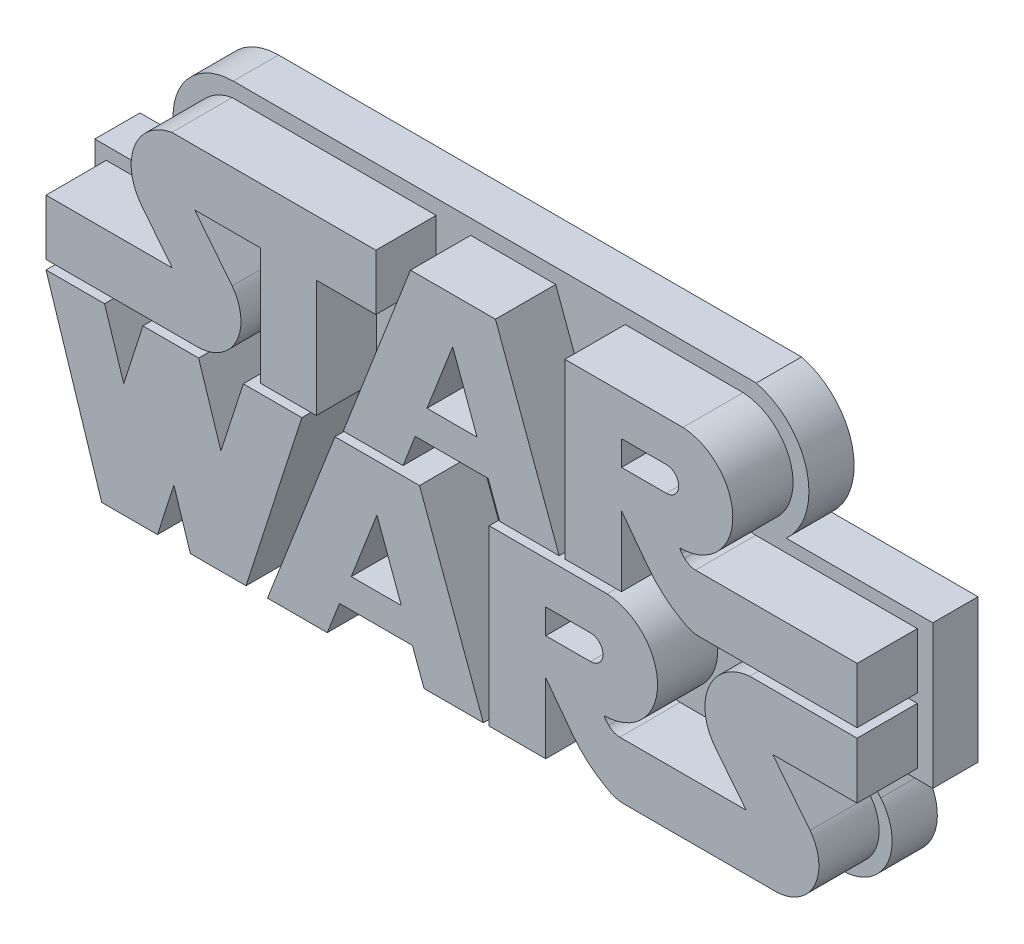
from build123d import *

# Parameters (mm, degrees)
BOSS_EXTRUDE1_DEPTH   = 17.78
BOSS_EXTRUDE1_2_DEPTH = 17.78
BOSS_EXTRUDE1_3_DEPTH = 17.78
BOSS_EXTRUDE1_4_DEPTH = 17.78
BOSS_EXTRUDE1_5_DEPTH = 17.78
BOSS_EXTRUDE1_6_DEPTH = 17.78
BOSS_EXTRUDE2_DEPTH   = 7.62


with BuildPart() as part:
    # Sketch1 → Boss-Extrude1 (new body)
    with BuildSketch(Plane.XY):
        with BuildLine():
            Line((-63.5, 10.16), (-63.5, 0.762))
            Line((-63.5, 0.762), (-38.022245391, 0.762))
            ThreePointArc((-38.022245391, 0.762), (-31.409051973, 4.854056156), (-32.119852619, 12.598345226))
            Line((-32.119852619, 12.598345226), (-38.427776706, 20.532214336))
            Line((-38.427776706, 20.532214336), (-27.33774172, 20.532214336))
            Line((-27.33774172, 20.532214336), (-27.33774172, 0.762))
            Line((-27.33774172, 0.762), (-17.932333685, 0.762))
            Line((-17.932333685, 0.762), (-17.932333685, 20.532214336))
            Line((-17.932333685, 20.532214336), (-7.881253338, 20.532214336))
            Line((-7.881253338, 20.532214336), (-7.881253338, 29.930214336))
            Line((-7.881253338, 29.930214336), (-42.276317647, 29.930214336))
            ThreePointArc((-42.276317647, 29.930214336), (-48.598760185, 24.736726392), (-47.348213221, 16.650829474))
            Line((-47.348213221, 16.650829474), (-42.18759625, 10.16))
            Line((-42.18759625, 10.16), (-63.5, 10.16))
        make_face()
    extrude(amount=BOSS_EXTRUDE1_DEPTH)



with BuildPart() as body_2:
    # Sketch1 → Boss-Extrude1 2 (new body)
    with BuildSketch(Plane.XY):
        with BuildLine():
            Line((73.255000443, 0.762), (73.255000443, 10.16))
            Line((73.255000443, 10.16), (46.009984972, 10.16))
            ThreePointArc((46.009984972, 10.16), (45.003789062, 10.367797223), (44.162226788, 10.95718914))
            Line((44.162226788, 10.95718914), (43.712774585, 11.43370613))
            ThreePointArc((43.712774585, 11.43370613), (43.556066702, 11.637854646), (43.443733283, 11.869404165))
            Line((43.443733283, 11.869404165), (43.366111034, 12.081925607))
            ThreePointArc((43.366111034, 12.081925607), (52.294019037, 20.754281762), (43.884526544, 29.930214336))
            Line((43.884526544, 29.930214336), (23.991875044, 29.930214336))
            Line((23.991875044, 29.930214336), (23.991875044, 0.762))
            Line((23.991875044, 0.762), (33.528766448, 0.762))
            Line((33.528766448, 0.762), (33.528766448, 12.598345226))
            Line((33.528766448, 12.598345226), (38.01751427, 6.623276383))
            ThreePointArc((38.01751427, 6.623276383), (40.598056426, 3.858045423), (43.705112819, 1.7012189))
            Line((43.705112819, 1.7012189), (44.28460982, 1.384459427))
            ThreePointArc((44.28460982, 1.384459427), (45.463753928, 0.920074253), (46.72115082, 0.762))
            Line((46.72115082, 0.762), (73.255000443, 0.762))
        make_face()
        with BuildLine():
            ThreePointArc((41.080111034, 23.113168002), (43.179680202, 21.013598834), (41.080111034, 18.914029667))
            Line((41.080111034, 18.914029667), (33.525986314, 18.914029667))
            Line((33.525986314, 18.914029667), (33.525986314, 23.113168314))
            Line((33.525986314, 23.113168314), (41.080111034, 23.113168002))
        make_face(mode=Mode.SUBTRACT)
    extrude(amount=BOSS_EXTRUDE1_2_DEPTH)


with BuildPart() as body_3:
    # Sketch1 → Boss-Extrude1 3 (new body)
    with BuildSketch(Plane.XY):
        Polygon((-2.050542709, 29.930214336), (-13.385046463, 0.762), (-3.302420584, 0.762), (-1.240737517, 6.067535635), (11.051079885, 6.067535635), (13.004416536, 0.762), (23.01912578, 0.762), (12.280277522, 29.930214336), align=None)
        Polygon((9.180778587, 11.147535635), (0.733304445, 11.147535635), (5.071020227, 22.310214336), align=None, mode=Mode.SUBTRACT)
    extrude(amount=BOSS_EXTRUDE1_3_DEPTH)


with BuildPart() as body_4:
    # Sketch1 → Boss-Extrude1 4 (new body)
    with BuildSketch(Plane.XY):
        with BuildLine():
            ThreePointArc((59.426367642, -30.01899549), (66.03956106, -25.926939334), (65.328760414, -18.182650263))
            Line((65.328760414, -18.182650263), (59.020836327, -10.248781153))
            Line((59.020836327, -10.248781153), (73.255000443, -10.248781153))
            Line((73.255000443, -10.248781153), (73.255000443, -0.762))
            Line((73.255000443, -0.762), (55.156904328, -0.762))
            ThreePointArc((55.156904328, -0.762), (48.27077915, -5.719302433), (49.389233963, -14.130166015))
            Line((49.389233963, -14.130166015), (54.549850935, -20.62099549))
            Line((54.549850935, -20.62099549), (33.237447184, -20.62099549))
            ThreePointArc((33.237447184, -20.62099549), (32.231251275, -20.413198267), (31.389689001, -19.82380635))
            Line((31.389689001, -19.82380635), (30.940236798, -19.347289359))
            ThreePointArc((30.940236798, -19.347289359), (30.783528915, -19.143140844), (30.671195496, -18.911591325))
            Line((30.671195496, -18.911591325), (30.625924739, -18.787644819))
            ThreePointArc((30.625924739, -18.787644819), (39.610601796, -10.010542083), (31.111988756, -0.762))
            Line((31.111988756, -0.762), (11.219337256, -0.762))
            Line((11.219337256, -0.762), (11.219337256, -30.01899549))
            Line((11.219337256, -30.01899549), (20.756228661, -30.01899549))
            Line((20.756228661, -30.01899549), (20.756228661, -18.182650263))
            Line((20.756228661, -18.182650263), (25.244976483, -24.157719107))
            ThreePointArc((25.244976483, -24.157719107), (27.825518639, -26.922950067), (30.932575032, -29.079776589))
            Line((30.932575032, -29.079776589), (31.512072033, -29.396536062))
            ThreePointArc((31.512072033, -29.396536062), (32.69121614, -29.860921236), (33.948613033, -30.01899549))
            Line((33.948613033, -30.01899549), (59.426367642, -30.01899549))
        make_face()
        with BuildLine():
            ThreePointArc((28.307573334, -7.854488563), (30.407142414, -9.954057774), (28.307573247, -12.053626898))
            Line((28.307573247, -12.053626898), (20.753448527, -12.053626898))
            Line((20.753448527, -12.053626898), (20.753448527, -7.85448825))
            Line((20.753448527, -7.85448825), (28.307573334, -7.854488563))
        make_face(mode=Mode.SUBTRACT)
    extrude(amount=BOSS_EXTRUDE1_4_DEPTH)


with BuildPart() as body_5:
    # Sketch1 → Boss-Extrude1 5 (new body)
    with BuildSketch(Plane.XY):
        Polygon((-14.788261104, -0.762), (-26.15726441, -30.01899549), (-16.072938963, -30.01899549), (-14.011255896, -24.713459854), (-1.719438494, -24.713459854), (0.233898158, -30.01899549), (10.246907832, -30.01899549), (-0.524626942, -0.762), align=None)
        Polygon((-3.591439361, -19.818595252), (-12.038913502, -19.818595252), (-7.701197721, -8.655916551), align=None, mode=Mode.SUBTRACT)
    extrude(amount=BOSS_EXTRUDE1_5_DEPTH)


with BuildPart() as body_6:
    # Sketch1 → Boss-Extrude1 6 (new body)
    with BuildSketch(Plane.XY):
        Polygon((-53.629040398, -0.762), (-63.5, -0.762), (-54.102, -30.01899549), (-44.704, -30.01899549), (-41.933974753, -21.395605814), (-39.163949505, -30.01899549), (-29.765949505, -30.01899549), (-20.367949505, -0.762), (-30.238909107, -0.762), (-34.002210372, -12.477565879), (-37.765511637, -0.762), (-47.163511637, -0.762), (-50.396276017, -10.825946893), align=None)
    extrude(amount=BOSS_EXTRUDE1_6_DEPTH)


with BuildPart() as part_1:
    add(part.part)

    add(body_2.part)  # Boss-Extrude2 merges body 2

    add(body_3.part)  # Boss-Extrude2 merges body 3

    add(body_4.part)  # Boss-Extrude2 merges body 4

    add(body_5.part)  # Boss-Extrude2 merges body 5

    add(body_6.part)  # Boss-Extrude2 merges body 6
    # Sketch2 → Boss-Extrude2 (add)
    with BuildSketch(Plane.XY):
        with BuildLine():
            Line((-55.151201275, -31.516967273), (-65.434483981, -0.083873468))
            Line((-65.434483981, -0.083873468), (-65.434483981, 12.305447779))
            Line((-65.434483981, 12.305447779), (-47.078741234, 12.305447779))
            Line((-47.078741234, 12.305447779), (-49.980640842, 15.906912471))
            ThreePointArc((-49.980640842, 15.906912471), (-51.234201523, 26.666707013), (-42.069273563, 32.441539344))
            Line((-42.069273563, 32.441539344), (46.103426171, 32.441539344))
            ThreePointArc((46.103426171, 32.441539344), (54.623601335, 23.874155401), (51.136703514, 12.305447779))
            Line((51.136703514, 12.305447779), (75.860238392, 12.305447779))
            Line((75.860238392, 12.305447779), (75.860238392, -11.870528257))
            Line((75.860238392, -11.870528257), (62.378876642, -11.870528257))
            Line((62.378876642, -11.870528257), (67.089261913, -17.64019673))
            ThreePointArc((67.089261913, -17.64019673), (68.184246101, -26.660573767), (60.504295946, -31.516967273))
            Line((60.504295946, -31.516967273), (-55.151201275, -31.516967273))
        make_face()
    extrude(amount=BOSS_EXTRUDE2_DEPTH)


solid = part_1.part
